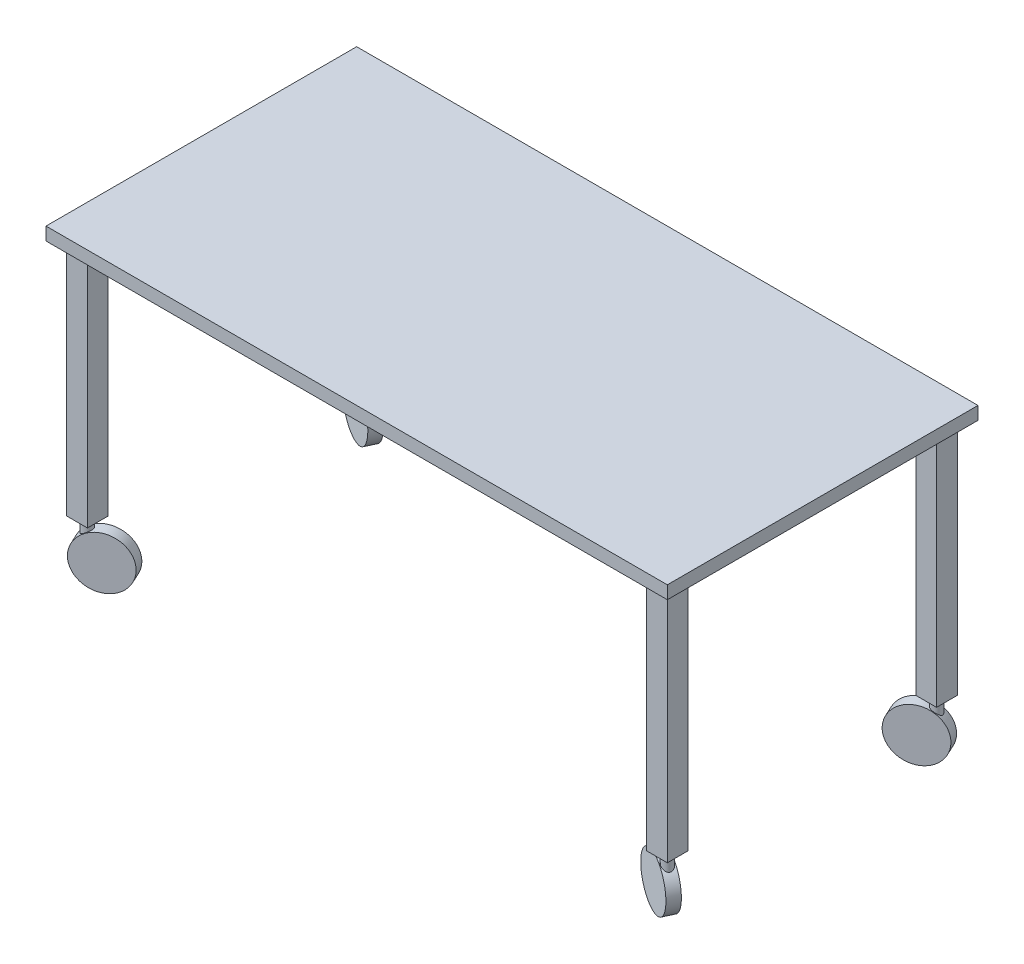
from build123d import *

# Parameters (mm, degrees)
SKETCH1_W               = 1524
SKETCH1_H               = 762
BOSS_EXTRUDE1_DEPTH     = 31.75
SKETCH2_W               = 50.8
SKETCH2_H               = 50.8
BOSS_EXTRUDE2_DEPTH     = 584.2
SKETCH3_R               = 12.7
BOSS_EXTRUDE3_DEPTH     = 101.6
SKETCH4_R               = 63.5
BOSS_EXTRUDE4_DEPTH     = 14.2875
MIRROR2_COPY_1_SKETCH_R = 63.5
MIRROR2_COPY_1_DEPTH    = 14.2875


with BuildPart() as part:
    # Sketch1 → Boss-Extrude1 (new body)
    with BuildSketch(Plane(origin=(0, 0, 0), x_dir=(1, 0, 0), z_dir=(0, 1, 0))):
        Rectangle(SKETCH1_W, SKETCH1_H)
    extrude(amount=-BOSS_EXTRUDE1_DEPTH)

    # Sketch2 → Boss-Extrude2 (add)
    with BuildSketch(Plane.XZ.offset(31.75)):
        with Locations((-711.2, 330.2)):
            Rectangle(SKETCH2_W, SKETCH2_H)
        with Locations((-711.2, -330.2)):
            Rectangle(SKETCH2_W, SKETCH2_H)
        with Locations((711.2, -330.2)):
            Rectangle(SKETCH2_W, SKETCH2_H)
        with Locations((711.2, 330.2)):
            Rectangle(SKETCH2_W, SKETCH2_H)
    extrude(amount=BOSS_EXTRUDE2_DEPTH)

    # Sketch3 → Boss-Extrude3 (add)
    with BuildSketch(Plane.XZ.offset(615.95)):
        with Locations((711.2, 330.2)):
            Circle(SKETCH3_R)
        with Locations((711.2, -330.2)):
            Circle(SKETCH3_R)
        with Locations((-711.2, -330.2)):
            Circle(SKETCH3_R)
        with Locations((-711.2, 330.2)):
            Circle(SKETCH3_R)
    extrude(amount=BOSS_EXTRUDE3_DEPTH)

    # Sketch4 → Boss-Extrude4 (add, symmetric)
    with BuildSketch(Plane(origin=(0, 0, 0), x_dir=(0.9070089677484316, 0, 0.42111130645462913), z_dir=(-0.4211113064546291, 0, 0.9070089677484315))):
        with Locations((752.365731254, -698.5)):
            Circle(SKETCH4_R)
    boss_extrude4 = extrude(amount=BOSS_EXTRUDE4_DEPTH, both=True)

    # Mirror1: Boss-Extrude4 across plane
    add(boss_extrude4.mirror(Plane.XY))

    # Mirror2: Boss-Extrude4 across plane
    add(boss_extrude4.mirror(Plane(origin=(0, 0, 0), x_dir=(0, 0, 1), z_dir=(1, 0, 0))))

    # Mirror2 copy 1 sketch → Mirror2 copy 1 (add, symmetric)
    with BuildSketch(Plane(origin=(0, 0, 0), x_dir=(-0.9070089677484316, 0, -0.42111130645462913), z_dir=(0.4211113064546291, 0, -0.9070089677484315))):
        with Locations((752.365731254, -698.5)):
            Circle(MIRROR2_COPY_1_SKETCH_R)
    extrude(amount=MIRROR2_COPY_1_DEPTH, both=True)


solid = part.part
